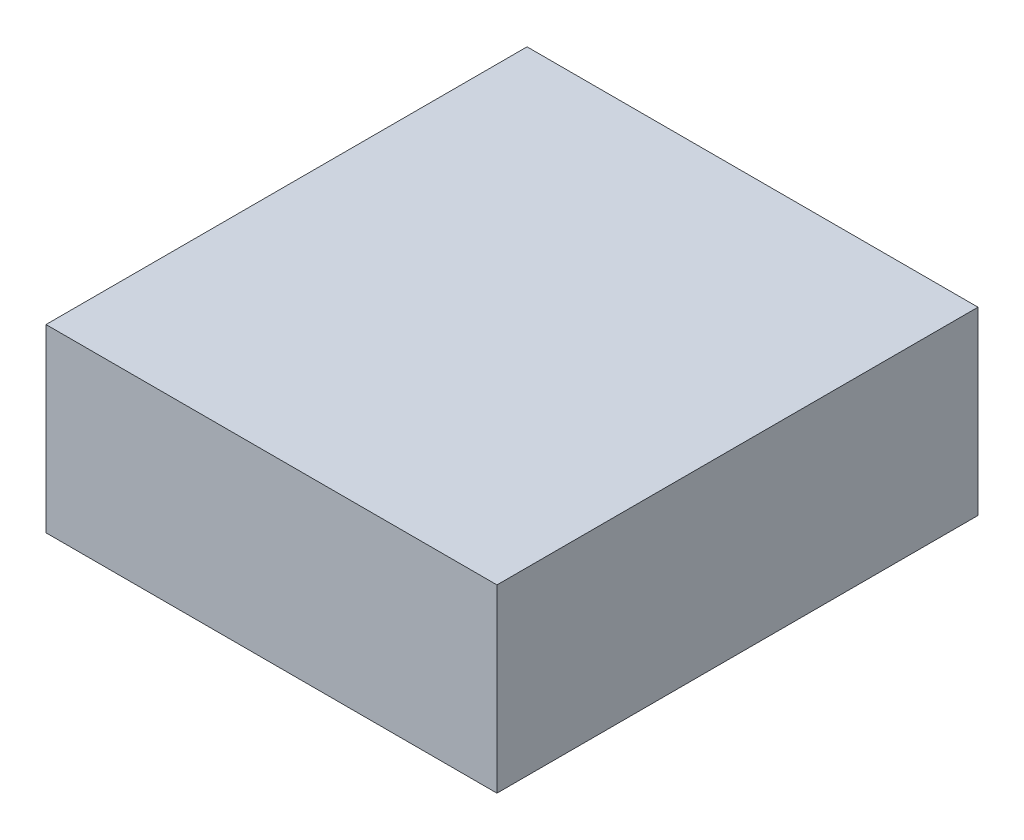
from build123d import *

# Parameters (mm, degrees)
SKIZZE2_W                       = 30
SKIZZE2_H                       = 32
AUFSATZ_LINEAR_AUSTRAGEN1_DEPTH = 12


with BuildPart() as part:
    # Skizze2 → Aufsatz-Linear austragen1 (new body)
    with BuildSketch(Plane(origin=(0, 0, 0), x_dir=(1, 0, 0), z_dir=(0, 1, 0))):
        Rectangle(SKIZZE2_W, SKIZZE2_H)
    extrude(amount=AUFSATZ_LINEAR_AUSTRAGEN1_DEPTH)


solid = part.part
